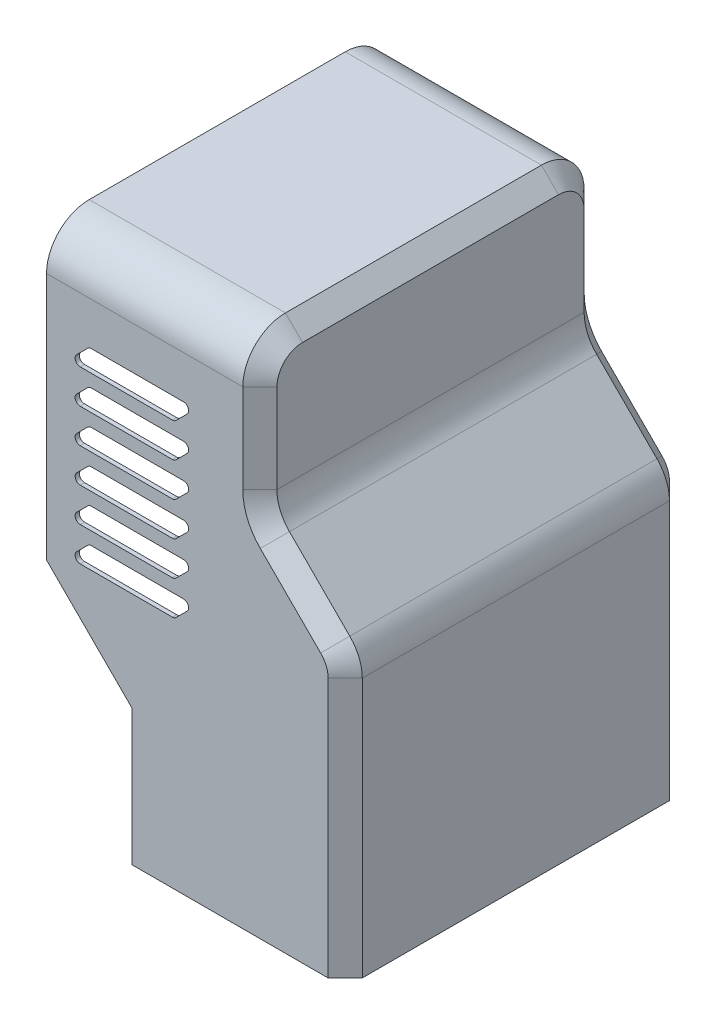
from build123d import *

# Parameters (mm, degrees)
BOSS_EXTRUDE1_DEPTH     = 2000
FILLET1_R               = 500
CHAMFER1_SIZE           = 200
SHELL1_T                = -50
CUT_EXTRUDE1_DEPTH      = 6801.735254368
CUT_EXTRUDE1_DEPTH_BACK = 6801.735254368


with BuildPart() as part:
    # Sketch1 → Boss-Extrude1 (new, symmetric)
    with BuildSketch(Plane.XY):
        Polygon((0, 0), (2500, 0), (2500, 3250), (1500, 4250), (1500, 6000), (-1000, 6000), (-1000, 2591.687604822), (0, 1591.687604822), align=None)
    extrude(amount=BOSS_EXTRUDE1_DEPTH, both=True)

    # Fillet1
    fillet1_edges = [part.edges().sort_by_distance(p)[0] for p in [
        (1500, 4250, 0),
        (2500, 3250, 0),
        (250, 6000, 2000),
        (250, 6000, -2000),
    ]]
    fillet(fillet1_edges, radius=FILLET1_R)

    # Chamfer1
    chamfer1_edges = [part.edges().sort_by_distance(p)[0] for p in [
        (2500, 1521.446609407, -2000),
        (2500, 1521.446609407, 2000),
        (2000, 3750, -2000),
        (2000, 3750, 2000),
        (1500, 4978.553390593, -2000),
        (2461.939766256, 3234.234934996, -2000),
        (1500, 4978.553390593, 2000),
        (2461.939766256, 3234.234934996, 2000),
        (1500, 6000, 0),
        (1500, 5853.553390593, 1853.553390593),
        (1500, 5853.553390593, -1853.553390593),
        (1538.060233744, 4265.765065004, -2000),
        (1538.060233744, 4265.765065004, 2000),
    ]]
    chamfer(chamfer1_edges, length=CHAMFER1_SIZE)

    # Shell1
    shell1_openings = [part.faces().sort_by_distance(p)[0] for p in [
        (-500, 2091.687604822, 0),
        (-1000, 4283.210771138, 0),
        (1245.247657296, 0, 0),
        (0, 795.843802411, 0),
    ]]
    offset(amount=SHELL1_T, openings=shell1_openings, kind=Kind.INTERSECTION)

    # Sketch2 → Cut-Extrude1 (cut, two sides: drawn at the far end of the back side and taken through both)
    with BuildSketch(Plane.XY.offset(-CUT_EXTRUDE1_DEPTH_BACK)):
        with BuildLine():
            Line((-517.573593129, 4982.426406871), (-647.573593129, 4852.426406871))
            ThreePointArc((-647.573593129, 4852.426406871), (-660.579958208, 4787.038994058), (-605.147186258, 4750))
            Line((-605.147186258, 4750), (475.147186258, 4750))
            ThreePointArc((475.147186258, 4750), (498.1081922, 4754.567228049), (517.573593129, 4767.573593129))
            Line((517.573593129, 4767.573593129), (647.573593129, 4897.573593129))
            ThreePointArc((647.573593129, 4897.573593129), (660.579958208, 4962.961005942), (605.147186258, 5000))
            Line((605.147186258, 5000), (-475.147186258, 5000))
            ThreePointArc((-475.147186258, 5000), (-498.1081922, 4995.432771951), (-517.573593129, 4982.426406871))
        make_face()
        with BuildLine():
            Line((-517.573593129, 4582.426406871), (-647.573593129, 4452.426406871))
            ThreePointArc((-647.573593129, 4452.426406871), (-660.579958208, 4387.038994058), (-605.147186258, 4350))
            Line((-605.147186258, 4350), (475.147186258, 4350))
            ThreePointArc((475.147186258, 4350), (498.1081922, 4354.567228049), (517.573593129, 4367.573593129))
            Line((517.573593129, 4367.573593129), (647.573593129, 4497.573593129))
            ThreePointArc((647.573593129, 4497.573593129), (660.579958208, 4562.961005942), (605.147186258, 4600))
            Line((605.147186258, 4600), (-475.147186258, 4600))
            ThreePointArc((-475.147186258, 4600), (-498.1081922, 4595.432771951), (-517.573593129, 4582.426406871))
        make_face()
        with BuildLine():
            Line((-517.573593129, 4182.426406871), (-647.573593129, 4052.426406871))
            ThreePointArc((-647.573593129, 4052.426406871), (-660.579958208, 3987.038994058), (-605.147186258, 3950))
            Line((-605.147186258, 3950), (475.147186258, 3950))
            ThreePointArc((475.147186258, 3950), (498.1081922, 3954.567228049), (517.573593129, 3967.573593129))
            Line((517.573593129, 3967.573593129), (647.573593129, 4097.573593129))
            ThreePointArc((647.573593129, 4097.573593129), (660.579958208, 4162.961005942), (605.147186258, 4200))
            Line((605.147186258, 4200), (-475.147186258, 4200))
            ThreePointArc((-475.147186258, 4200), (-498.1081922, 4195.432771951), (-517.573593129, 4182.426406871))
        make_face()
        with BuildLine():
            Line((-517.573593129, 3782.426406871), (-647.573593129, 3652.426406871))
            ThreePointArc((-647.573593129, 3652.426406871), (-660.579958208, 3587.038994058), (-605.147186258, 3550))
            Line((-605.147186258, 3550), (475.147186258, 3550))
            ThreePointArc((475.147186258, 3550), (498.1081922, 3554.567228049), (517.573593129, 3567.573593129))
            Line((517.573593129, 3567.573593129), (647.573593129, 3697.573593129))
            ThreePointArc((647.573593129, 3697.573593129), (660.579958208, 3762.961005942), (605.147186258, 3800))
            Line((605.147186258, 3800), (-475.147186258, 3800))
            ThreePointArc((-475.147186258, 3800), (-498.1081922, 3795.432771951), (-517.573593129, 3782.426406871))
        make_face()
        with BuildLine():
            Line((-517.573593129, 3382.426406871), (-647.573593129, 3252.426406871))
            ThreePointArc((-647.573593129, 3252.426406871), (-660.579958208, 3187.038994058), (-605.147186258, 3150))
            Line((-605.147186258, 3150), (475.147186258, 3150))
            ThreePointArc((475.147186258, 3150), (498.1081922, 3154.567228049), (517.573593129, 3167.573593129))
            Line((517.573593129, 3167.573593129), (647.573593129, 3297.573593129))
            ThreePointArc((647.573593129, 3297.573593129), (660.579958208, 3362.961005942), (605.147186258, 3400))
            Line((605.147186258, 3400), (-475.147186258, 3400))
            ThreePointArc((-475.147186258, 3400), (-498.1081922, 3395.432771951), (-517.573593129, 3382.426406871))
        make_face()
        with BuildLine():
            Line((-517.573593129, 2982.426406871), (-647.573593129, 2852.426406871))
            ThreePointArc((-647.573593129, 2852.426406871), (-660.579958208, 2787.038994058), (-605.147186258, 2750))
            Line((-605.147186258, 2750), (475.147186258, 2750))
            ThreePointArc((475.147186258, 2750), (498.1081922, 2754.567228049), (517.573593129, 2767.573593129))
            Line((517.573593129, 2767.573593129), (647.573593129, 2897.573593129))
            ThreePointArc((647.573593129, 2897.573593129), (660.579958208, 2962.961005942), (605.147186258, 3000))
            Line((605.147186258, 3000), (-475.147186258, 3000))
            ThreePointArc((-475.147186258, 3000), (-498.108192199, 2995.432771951), (-517.573593129, 2982.426406871))
        make_face()
    extrude(amount=CUT_EXTRUDE1_DEPTH + CUT_EXTRUDE1_DEPTH_BACK, mode=Mode.SUBTRACT)


solid = part.part
